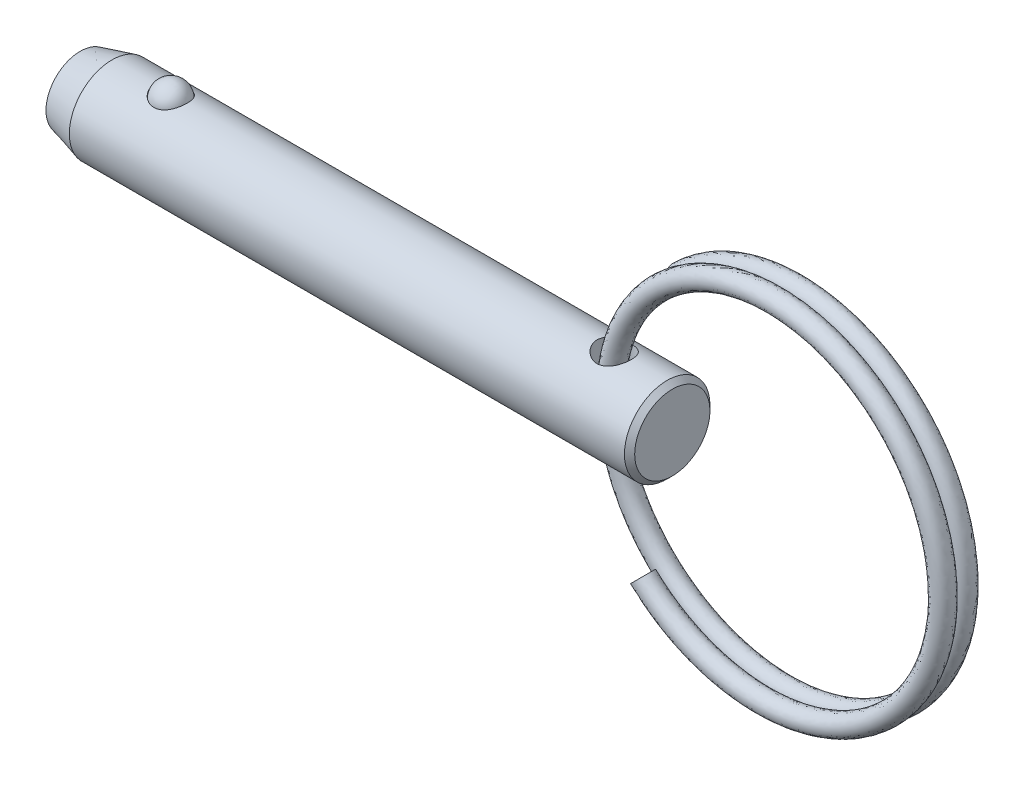
from build123d import *

# Parameters (mm, degrees)
SKETCH4_W          = 1.27
SKETCH4_H          = 6.35
SWEEP1_PITCH       = 1.5494
SWEEP1_HEIGHT      = 1.355725
SWEEP1_RADIUS      = 13.462
SKETCH6_R          = 0.762
SWEEP2_PITCH       = 1.5494
SWEEP2_HEIGHT      = 1.355725
SWEEP2_RADIUS      = 13.462
SWEEP2_START_ANGLE = -180
SKETCH6_2_R        = 0.762


with BuildPart() as part:
    # Sketch1 → Revolve1 (revolve)
    with BuildSketch(Plane.XY, mode=Mode.PRIVATE) as revolve1_sk:
        Polygon((21.9964, 2.794), (21.6154, 3.175), (-19.626547737, 3.175), (-21.9964, 2.54), (-21.9964, 0), (21.9964, 0), align=None)
    revolve(revolve1_sk.sketch.rotate(Axis((21.9964, 0, 0), (1, 0, 0)), 90), axis=Axis((21.9964, 0, 0), (1, 0, 0)))

    # Sketch2 → Cut-Revolve1 (revolve, cut)
    with BuildSketch(Plane.XY):
        with BuildLine():
            Line((-14.004582051, 2.8575), (-16.519182051, 2.8575))
            ThreePointArc((-16.519182051, 2.8575), (-15.261882051, 4.1148), (-14.004582051, 2.8575))
        make_face()
    revolve(axis=Axis((-14.004582051, 2.8575, 0), (1, 0, 0)), mode=Mode.SUBTRACT)

    # Sketch4 → Cut-Revolve2 (revolve, cut)
    with BuildSketch(Plane.XY, mode=Mode.PRIVATE) as cut_revolve2_sk:
        with Locations((18.3134, 0)):
            Rectangle(SKETCH4_W, SKETCH4_H)
    revolve(cut_revolve2_sk.sketch.rotate(Axis((17.6784, -3.175, 0), (0, 1, 0)), 90), axis=Axis((17.6784, -3.175, 0), (0, 1, 0)), mode=Mode.SUBTRACT)


with BuildPart() as body_2:
    # Sketch3 → Revolve2 (revolve)
    with BuildSketch(Plane.XY):
        with BuildLine():
            Line((-14.029982051, 2.8575), (-16.493782051, 2.8575))
            ThreePointArc((-16.493782051, 2.8575), (-15.261882051, 4.0894), (-14.029982051, 2.8575))
        make_face()
    revolve(axis=Axis((-14.029982051, 2.8575, 0), (1, 0, 0)))


with BuildPart() as body_3:
    # Sweep1: sweep along a helix
    with BuildLine() as sweep1_path:
        Helix(SWEEP1_PITCH, SWEEP1_HEIGHT, SWEEP1_RADIUS, center=(30.163425091, 0, 0), direction=(0, 0, -1), lefthand=True)
    # Sketch6 → Sweep1 (sweep)
    with BuildSketch(Plane(origin=(114.003847968, 0, 0), x_dir=(0, 0, -1), z_dir=(0, 1, 0))):
        with Locations((0, 96.540422877)):
            Circle(SKETCH6_R)
    sweep(path=sweep1_path.line, is_frenet=True)

    # Sweep2: sweep along a helix
    with BuildLine() as sweep2_path:
        add(Helix(SWEEP2_PITCH, SWEEP2_HEIGHT, SWEEP2_RADIUS, center=(30.163425091, 0, 0), direction=(0, 0, 1), lefthand=True, mode=Mode.PRIVATE).rotate(Axis((30.163425091, 0, 0), (0, 0, 1)), SWEEP2_START_ANGLE))
    # Sketch6<2> → Sweep2 (sweep)
    with BuildSketch(Plane(origin=(114.003847968, 0, 0), x_dir=(0, 0, -1), z_dir=(0, 1, 0))):
        with Locations((0, 96.540422877)):
            Circle(SKETCH6_2_R)
    sweep(path=sweep2_path.line, is_frenet=True)


solid = Compound([part.part, body_2.part, body_3.part])
